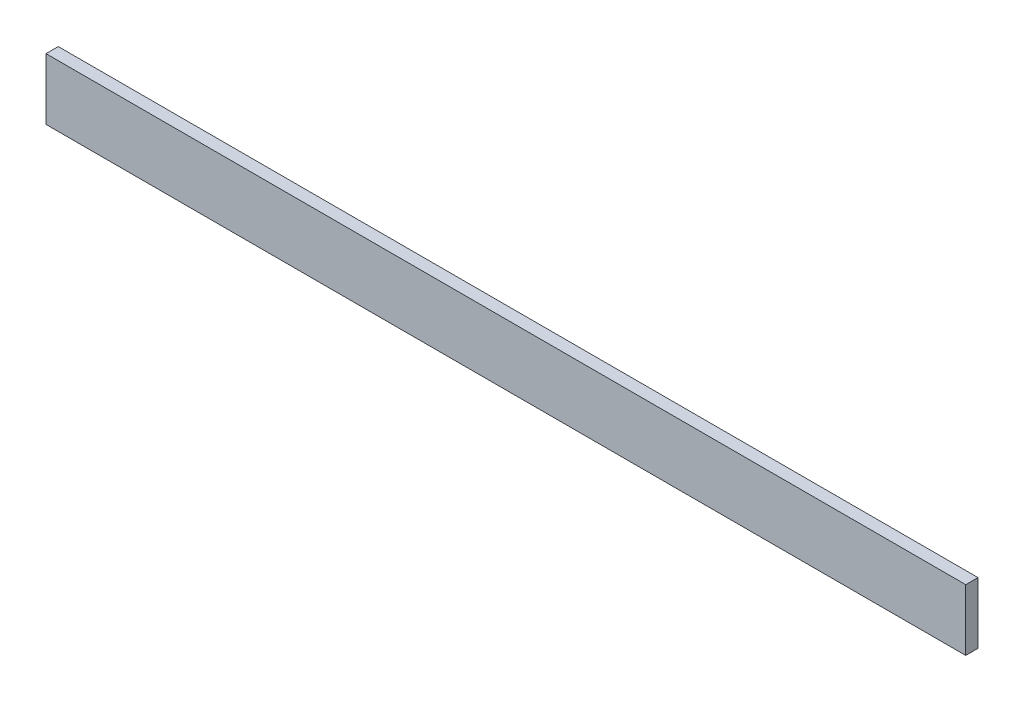
from build123d import *

# Parameters (mm, degrees)
SKETCH_1_W      = 75
SKETCH_1_H      = 5
EXTRUDE_1_DEPTH = 1


with BuildPart() as part:
    # 草图1 → 凸台-拉伸1 (new body)
    with BuildSketch(Plane.XY):
        with Locations((37.5, 2.5)):
            Rectangle(SKETCH_1_W, SKETCH_1_H)
    extrude(amount=EXTRUDE_1_DEPTH)


solid = part.part
